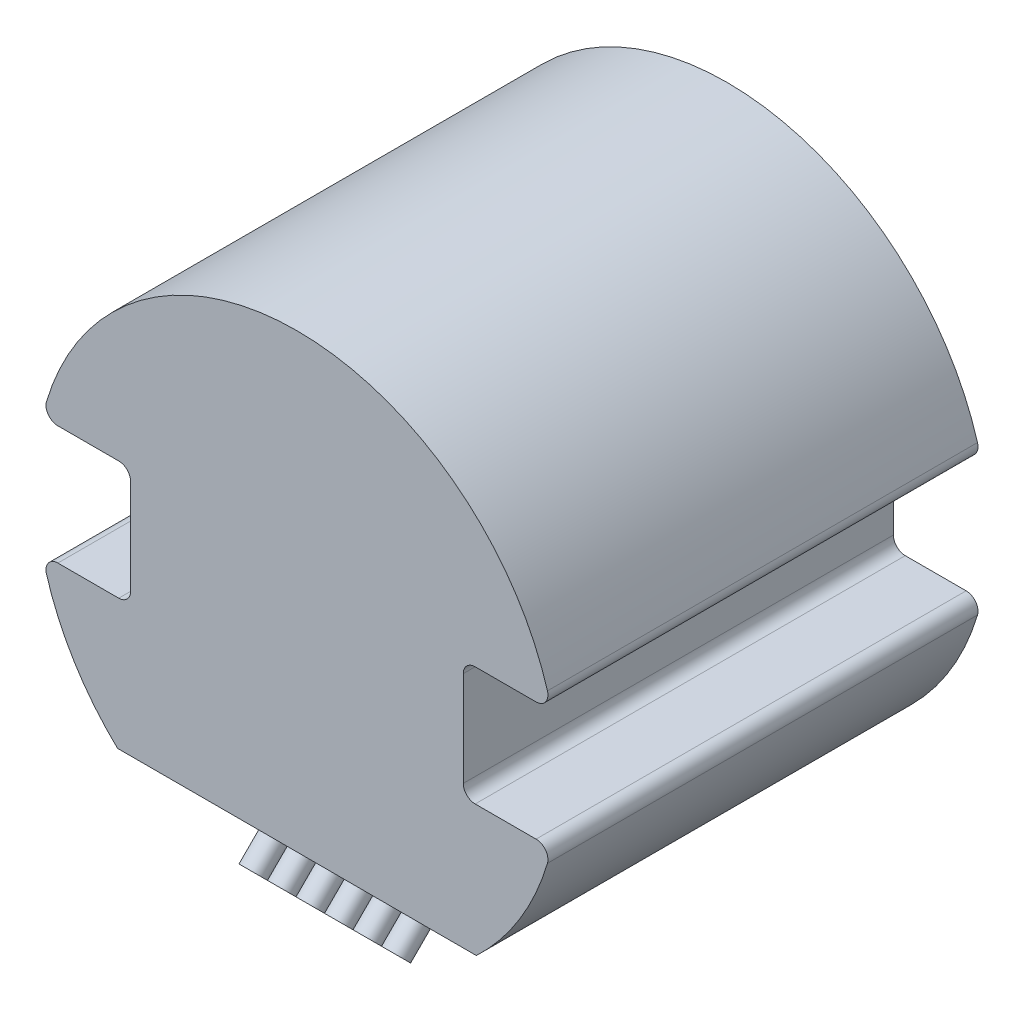
from build123d import *

# Parameters (mm, degrees)
ESQUISSE1_R             = 11
BOSS_EXTRU_1_DEPTH      = 18.1
ENL_V_MAT_EXTRU_2_DEPTH = 24.866503724
ENL_V_START             = -4
ENL_V_MAT_EXTRU_3_DEPTH = 4
CONG_1_R                = 0.5
ESQUISSE6_R             = 0.5
BOSS_EXTRU_2_DEPTH      = 4


with BuildPart() as part:
    # Esquisse1 → Boss.-Extru.1 (new body)
    with BuildSketch(Plane.XY):
        with Locations(Location((0, 0, 0), (0, 0, 180))):
            Circle(ESQUISSE1_R)
    extrude(amount=BOSS_EXTRU_1_DEPTH)

    # Esquisse4 → Enlèv. mat.-Extru.2 (cut, through all)
    with BuildSketch(Plane.XY.offset(18.1)):
        with BuildLine():
            Line((10.712142643, 2.5), (7, 2.5))
            Line((7, 2.5), (7, -2.5))
            Line((7, -2.5), (10.712142643, -2.5))
            ThreePointArc((10.712142643, -2.5), (11, 0), (10.712142643, 2.5))
        make_face()
        with BuildLine():
            Line((-10.712142643, -2.5), (-7, -2.5))
            Line((-7, -2.5), (-7, 2.5))
            Line((-7, 2.5), (-10.712142643, 2.5))
            ThreePointArc((-10.712142643, 2.5), (-11, 0), (-10.712142643, -2.5))
        make_face()
    extrude(amount=-ENL_V_MAT_EXTRU_2_DEPTH, mode=Mode.SUBTRACT)

    # Esquisse5 → Enlèv. mat.-Extru.3 (cut)
    with BuildSketch(Plane.XY.offset(18.1).offset(ENL_V_START)):
        with BuildLine():
            Line((-7.549834435, -8), (7.549834435, -8))
            ThreePointArc((7.549834435, -8), (0, -11), (-7.549834435, -8))
        make_face()
    extrude(amount=ENL_V_MAT_EXTRU_3_DEPTH, mode=Mode.SUBTRACT)

    # Congé1
    cong_1_edges = [part.edges().sort_by_distance(p)[0] for p in [
        (10.712142643, 2.5, 9.05),
        (10.712142643, -2.5, 9.05),
        (7, -2.5, 9.05),
        (7, 2.5, 9.05),
        (-10.712142643, -2.5, 9.05),
        (-10.712142643, 2.5, 9.05),
        (-7, 2.5, 9.05),
        (-7, -2.5, 9.05),
    ]]
    fillet(cong_1_edges, radius=CONG_1_R)

    # Esquisse6 → Boss.-Extru.2 (add)
    with BuildSketch(Plane(origin=(0, -11.05, 11.05), x_dir=(-1, 0, 0), z_dir=(0, -0.7071067811865464, 0.7071067811865488))):
        with Locations(Location((0.6, -4.313351365, 0), (0, 0, 180))):
            Circle(ESQUISSE6_R)
        with Locations(Location((1.8, -4.313351365, 0), (0, 0, 180))):
            Circle(ESQUISSE6_R)
        with Locations(Location((3, -4.313351365, 0), (0, 0, 180))):
            Circle(ESQUISSE6_R)
        with Locations(Location((-3, -4.313351365, 0), (0, 0, 270))):
            Circle(ESQUISSE6_R)
        with Locations(Location((-1.8, -4.313351365, 0), (0, 0, 270))):
            Circle(ESQUISSE6_R)
        with Locations(Location((-0.6, -4.313351365, 0), (0, 0, 270))):
            Circle(ESQUISSE6_R)
    extrude(amount=BOSS_EXTRU_2_DEPTH)


solid = part.part
